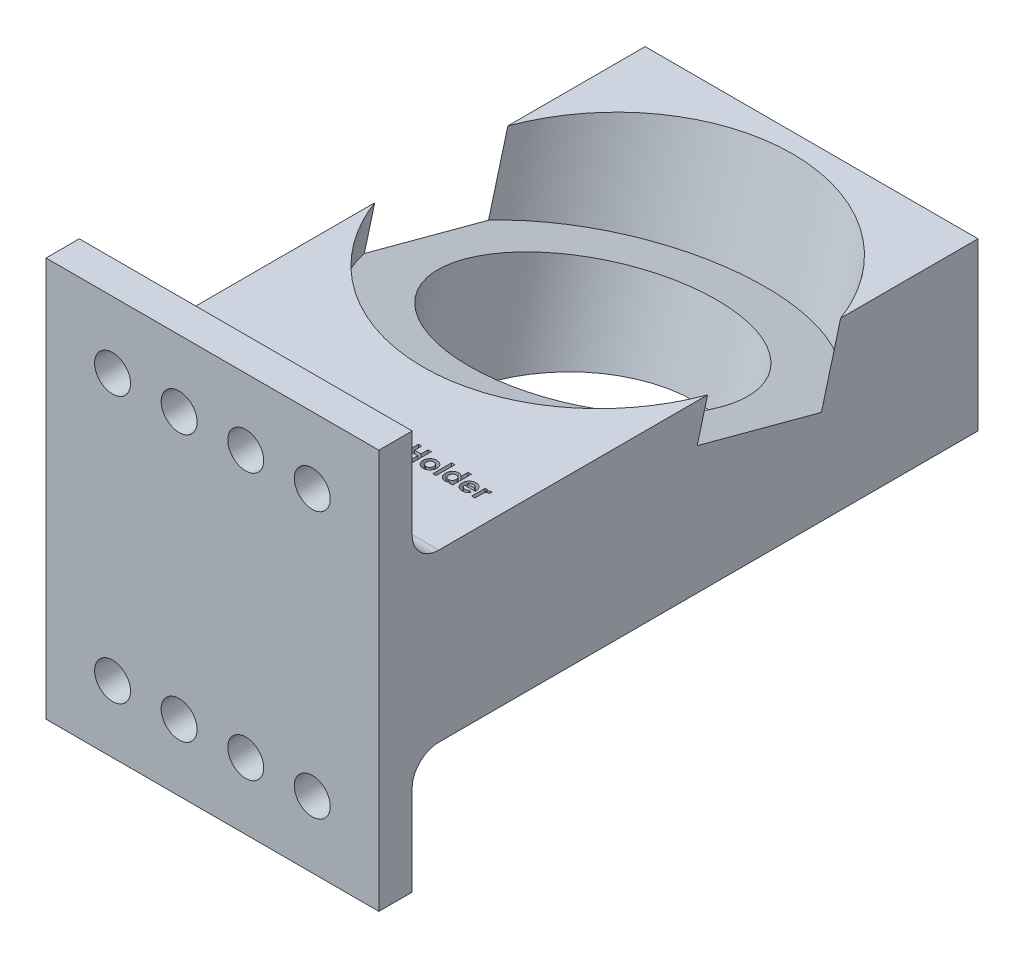
from build123d import *

# Parameters (mm, degrees)
SKETCH1_W           = 107.95
SKETCH1_H           = 31.75
BOSS_EXTRUDE1_DEPTH = 31.75
SKETCH3_W           = 63.5
SKETCH3_H           = 76.2
SKETCH3_R           = 3.429
BOSS_EXTRUDE2_DEPTH = 6.35
FILLET1_R           = 5.08
SKETCH4_W           = 0.628205128
SKETCH4_H           = 3.58974359
SKETCH4_W_2         = 0.628205129
CUT_EXTRUDE1_DEPTH  = 2.54


with BuildPart() as part:
    # Sketch1 → Boss-Extrude1 (new, symmetric)
    with BuildSketch(Plane(origin=(0, 0, 0), x_dir=(0, 0, -1), z_dir=(1, 0, 0))):
        Rectangle(SKETCH1_W, SKETCH1_H)
    extrude(amount=BOSS_EXTRUDE1_DEPTH, both=True)

    # Sketch2 → Cut-Revolve1 (revolve, cut)
    with BuildSketch(Plane(origin=(0, 0, 0), x_dir=(0, 0, -1), z_dir=(1, 0, 0))):
        Polygon((35.867113889, -1.024256513), (26.789471638, -34.902478605), (3.175, -28.575), (21.014173595, 38.001702221), (53.890425018, 29.192537202), (45.128893674, -3.505942927), align=None)
    revolve(axis=Axis((0, -40.424261314, 0), (0, 0.9659258262890701, -0.2588190451025143)), mode=Mode.SUBTRACT)

    # Sketch3 → Boss-Extrude2 (add)
    with BuildSketch(Plane.XY.offset(53.975)):
        Rectangle(SKETCH3_W, SKETCH3_H)
        with Locations((-19.05, 25.4)):
            Circle(SKETCH3_R, mode=Mode.SUBTRACT)
        with Locations((-6.35, 25.4)):
            Circle(SKETCH3_R, mode=Mode.SUBTRACT)
        with Locations((6.35, 25.4)):
            Circle(SKETCH3_R, mode=Mode.SUBTRACT)
        with Locations((19.05, 25.4)):
            Circle(SKETCH3_R, mode=Mode.SUBTRACT)
        with Locations((-6.35, -25.4)):
            Circle(SKETCH3_R, mode=Mode.SUBTRACT)
        with Locations((6.35, -25.4)):
            Circle(SKETCH3_R, mode=Mode.SUBTRACT)
        with Locations((19.05, -25.4)):
            Circle(SKETCH3_R, mode=Mode.SUBTRACT)
        with Locations((-19.05, -25.4)):
            Circle(SKETCH3_R, mode=Mode.SUBTRACT)
    extrude(amount=BOSS_EXTRUDE2_DEPTH)

    # Fillet1
    fillet1_edges = [part.edges().sort_by_distance(p)[0] for p in [
        (0, 15.875, 53.975),
        (0, -15.875, 53.975),
    ]]
    fillet(fillet1_edges, radius=FILLET1_R)

    # Sketch4 → Cut-Extrude1 (cut)
    # profile 1 of 19: a face of its own
    with BuildSketch(Plane(origin=(0, 15.875, 0), x_dir=(1, 0, 0), z_dir=(0, 1, 0))):
        with BuildLine():
            Line((-25.837740385, -33.244778991), (-25.281750801, -33.526629953))
            Line((-25.281750801, -33.526629953), (-25.891726763, -34.725548222))
            add(Edge.make_bspline(
                [(-25.891726763, -34.725548222), (-25.855689955, -34.726481233), (-25.784709553, -34.728318951), (-25.680276294, -34.743171699), (-25.580436155, -34.768848538), (-25.484182451, -34.802883118), (-25.392691793, -34.848591898), (-25.304490673, -34.902964876), (-25.221860898, -34.969278571), (-25.142907839, -35.042750627), (-25.071116228, -35.124147106), (-25.008752522, -35.211610208), (-24.954403653, -35.303011945), (-24.91215503, -35.400397197), (-24.878075883, -35.502151691), (-24.853486279, -35.608682185), (-24.839457222, -35.720297166), (-24.837523082, -35.796122279), (-24.836538462, -35.834722901)],
                knots=[0, 0, 0, 0, 1.013260694, 1.995783107, 2.958651975, 3.908806537, 4.861209129, 5.829647963, 6.817170299, 7.835534541, 8.860094905, 9.863329007, 10.853101798, 11.844815043, 12.84250023, 13.867713965, 14.914507806, 16, 16, 16, 16], degree=3))
            add(Edge.make_bspline(
                [(-24.836538462, -35.834722901), (-24.837461133, -35.87193156), (-24.839284858, -35.945477122), (-24.854360363, -36.053496848), (-24.878723171, -36.157135459), (-24.913542515, -36.256185974), (-24.957800718, -36.351132556), (-25.011925502, -36.441919489), (-25.076365728, -36.527868352), (-25.149456438, -36.608522454), (-25.229357192, -36.682039264), (-25.31357694, -36.747385284), (-25.402829348, -36.801363575), (-25.495427441, -36.846949508), (-25.593076006, -36.880966488), (-25.694313729, -36.906643416), (-25.799908325, -36.921460118), (-25.871583231, -36.923323335), (-25.907852564, -36.924266171)],
                knots=[0, 0, 0, 0, 1.049934834, 2.075270938, 3.072134561, 4.05064612, 5.033440221, 6.024524368, 7.028587226, 8.060776465, 9.092543989, 10.090062252, 11.064205434, 12.031961459, 12.998029633, 13.977230324, 14.976426867, 16, 16, 16, 16], degree=3))
            add(Edge.make_bspline(
                [(-25.907852564, -36.924266171), (-25.945779265, -36.923492436), (-26.020356991, -36.92197099), (-26.129482869, -36.904934814), (-26.234143977, -36.879289225), (-26.333752104, -36.842671681), (-26.428926683, -36.796046185), (-26.518547205, -36.738351823), (-26.603368599, -36.67022481), (-26.682486544, -36.593197896), (-26.753765916, -36.50882545), (-26.817341158, -36.421224884), (-26.871125896, -36.330258733), (-26.914663387, -36.236024259), (-26.948632347, -36.138821742), (-26.972267815, -36.038466701), (-26.987668504, -35.935225327), (-26.989473883, -35.865159888), (-26.990384615, -35.829815049)],
                knots=[0, 0, 0, 0, 1.063775006, 2.091769615, 3.092589432, 4.084662827, 5.064601646, 6.061867366, 7.070035304, 8.113879863, 9.156342271, 10.166834137, 11.149076039, 12.117706134, 13.076241869, 14.034148791, 15.008317125, 16, 16, 16, 16], degree=3))
            add(Edge.make_bspline(
                [(-26.990384615, -35.829815049), (-26.989903402, -35.802444605), (-26.988938298, -35.747551363), (-26.979239574, -35.665351716), (-26.964494107, -35.582936303), (-26.94740218, -35.513391567), (-26.92980264, -35.454584215), (-26.912088568, -35.404817142), (-26.890135879, -35.349586574), (-26.865040704, -35.288751472), (-26.83601389, -35.222385023), (-26.803207069, -35.150668123), (-26.766538566, -35.073057679), (-26.740388873, -35.019751321), (-26.726762821, -34.991974504)],
                knots=[0, 0, 0, 0, 1.110454016, 2.227089276, 3.35462975, 4.507227546, 5.131400587, 5.845402449, 6.650387134, 7.543487832, 8.516250726, 9.590168902, 10.744287919, 12, 12, 12, 12], degree=3))
            Line((-26.726762821, -34.991974504), (-25.837740385, -33.244778991))
        make_face()
        with BuildLine():
            add(Edge.make_bspline(
                [(-25.921875, -35.308881555), (-25.952018194, -35.31026416), (-26.011004468, -35.312969736), (-26.094874128, -35.341303842), (-26.171344229, -35.385753003), (-26.237629459, -35.447657056), (-26.293070954, -35.52163483), (-26.33381131, -35.606016363), (-26.358318899, -35.699675606), (-26.36086508, -35.765160587), (-26.362179487, -35.79896569)],
                knots=[0, 0, 0, 0, 0.981744412, 1.921144944, 2.858899012, 3.85339082, 4.86292663, 5.863643845, 6.897155691, 8, 8, 8, 8], degree=3))
            add(Edge.make_bspline(
                [(-26.362179487, -35.79896569), (-26.360623188, -35.83278205), (-26.357596082, -35.89855713), (-26.332166976, -35.993108176), (-26.29053164, -36.079405916), (-26.232140736, -36.154364056), (-26.163590653, -36.216585116), (-26.087576742, -36.262600565), (-26.005366943, -36.290869365), (-25.948500417, -36.294318534), (-25.919771635, -36.296061042)],
                knots=[0, 0, 0, 0, 1.098279937, 2.136227893, 3.159405121, 4.194678092, 5.206500211, 6.154139736, 7.067477469, 8, 8, 8, 8], degree=3))
            add(Edge.make_bspline(
                [(-25.919771635, -36.296061042), (-25.889430794, -36.294287498), (-25.829927135, -36.290809271), (-25.744089206, -36.26372997), (-25.665675742, -36.218485431), (-25.596343072, -36.156463577), (-25.536787626, -36.08236081), (-25.495581273, -35.995556169), (-25.468976568, -35.900322687), (-25.466186218, -35.833508857), (-25.46474359, -35.79896569)],
                knots=[0, 0, 0, 0, 0.96921794, 1.900804717, 2.848419905, 3.844199796, 4.861108892, 5.867439427, 6.897452859, 8, 8, 8, 8], degree=3))
            add(Edge.make_bspline(
                [(-25.46474359, -35.79896569), (-25.466387007, -35.765180326), (-25.469569677, -35.699751023), (-25.493475297, -35.605653008), (-25.536157169, -35.521596713), (-25.592853073, -35.447351687), (-25.661419488, -35.385475238), (-25.740950079, -35.340953302), (-25.828651045, -35.313019935), (-25.890347278, -35.310281128), (-25.921875, -35.308881555)],
                knots=[0, 0, 0, 0, 1.083229974, 2.097801324, 3.086792542, 4.086858909, 5.079819718, 6.026392613, 6.991456328, 8, 8, 8, 8], degree=3))
        make_face(mode=Mode.SUBTRACT)
    # profile 2 of 19: a face of its own
    with BuildSketch(Plane(origin=(0, 15.875, 0), x_dir=(1, 0, 0), z_dir=(0, 1, 0))):
        Polygon((-24.253205128, -33.334522581), (-22.009615385, -33.334522581), (-22.009615385, -33.660544216), (-23.553485577, -36.924266171), (-24.110176282, -36.643817453), (-22.820112179, -33.917855914), (-24.253205128, -33.917855914), align=None)
    # profile 3 of 19: a face of its own
    with BuildSketch(Plane(origin=(0, 15.875, 0), x_dir=(1, 0, 0), z_dir=(0, 1, 0))):
        with BuildLine():
            add(Edge.make_bspline(
                [(-20.516927083, -33.244778991), (-20.486519348, -33.245230403), (-20.426729615, -33.246117998), (-20.338670594, -33.25573138), (-20.253845409, -33.270254518), (-20.171922215, -33.290509232), (-20.093490703, -33.317315624), (-20.017980032, -33.349402415), (-19.946288997, -33.388452625), (-19.877503309, -33.432561843), (-19.811649465, -33.48249973), (-19.750310214, -33.5394315), (-19.692365373, -33.602047151), (-19.639069233, -33.671293318), (-19.589241535, -33.746540134), (-19.543046006, -33.827799531), (-19.500836282, -33.91546922), (-19.462139294, -34.009707407), (-19.427536325, -34.111926682), (-19.398390287, -34.223299544), (-19.373392683, -34.343851428), (-19.352292941, -34.473882405), (-19.336344947, -34.613565317), (-19.325595677, -34.762807367), (-19.31821902, -34.921320837), (-19.317616988, -35.030059775), (-19.317307692, -35.085924825)],
                knots=[0, 0, 0, 0, 0.879237366, 1.728815576, 2.559023295, 3.367336655, 4.166867292, 4.954216142, 5.737608147, 6.525189134, 7.316157332, 8.124696809, 8.942788509, 9.781158001, 10.649253743, 11.551476218, 12.482711956, 13.461909668, 14.496590415, 15.601789533, 16.789733467, 18.056700938, 19.410929216, 20.8549011, 22.384193279, 24, 24, 24, 24], degree=3))
            add(Edge.make_bspline(
                [(-19.317307692, -35.085924825), (-19.317641958, -35.142488809), (-19.318291429, -35.252391616), (-19.325289027, -35.412354931), (-19.337339222, -35.562680567), (-19.352870382, -35.703352973), (-19.374143824, -35.834297862), (-19.399057981, -35.955854292), (-19.42866408, -36.067978203), (-19.464406859, -36.170416956), (-19.502869613, -36.264820646), (-19.545194799, -36.3523194), (-19.590644693, -36.433150212), (-19.638176814, -36.508532526), (-19.690397045, -36.57624411), (-19.744763682, -36.63858751), (-19.803643944, -36.693187988), (-19.864558746, -36.742859406), (-19.929739642, -36.785785479), (-19.99851444, -36.823327915), (-20.072109274, -36.85377929), (-20.149182636, -36.880264269), (-20.231048257, -36.899277626), (-20.316405303, -36.914364101), (-20.406217439, -36.922701812), (-20.467365158, -36.92373616), (-20.498697917, -36.924266171)],
                knots=[0, 0, 0, 0, 1.643780988, 3.193836972, 4.651895693, 6.025988579, 7.305620092, 8.505800249, 9.631074763, 10.672816429, 11.65661981, 12.592235626, 13.49536222, 14.350718032, 15.179365177, 15.97804903, 16.751647189, 17.51006938, 18.259804725, 19.016521909, 19.783502495, 20.571750527, 21.382245291, 22.22305063, 23.089471752, 24, 24, 24, 24], degree=3))
            add(Edge.make_bspline(
                [(-20.498697917, -36.924266171), (-20.53002983, -36.923725936), (-20.591408586, -36.922667624), (-20.681463583, -36.914426095), (-20.767272978, -36.899216511), (-20.849786288, -36.880118299), (-20.928429232, -36.853837891), (-21.0035789, -36.822475433), (-21.074657457, -36.785167243), (-21.141861708, -36.742141156), (-21.204962198, -36.692802077), (-21.26493951, -36.637677743), (-21.321660969, -36.57690788), (-21.374263701, -36.509811816), (-21.423609188, -36.437285142), (-21.469182833, -36.35849964), (-21.510957249, -36.273570019), (-21.550239146, -36.182377897), (-21.584370142, -36.082960011), (-21.614745144, -35.974428572), (-21.639627546, -35.855878881), (-21.65963964, -35.727349024), (-21.675617283, -35.589111296), (-21.687502814, -35.441098975), (-21.69453928, -35.283243119), (-21.695181941, -35.174740926), (-21.695512821, -35.118877549)],
                knots=[0, 0, 0, 0, 0.917216111, 1.796812873, 2.643793957, 3.46689424, 4.273913431, 5.068098542, 5.848489301, 6.620921603, 7.401012384, 8.190319798, 9.003608147, 9.831726257, 10.68377682, 11.569763213, 12.493818149, 13.453288342, 14.474581811, 15.568529029, 16.750744269, 18.018426408, 19.375425659, 20.823733699, 22.36466933, 24, 24, 24, 24], degree=3))
            add(Edge.make_bspline(
                [(-21.695512821, -35.118877549), (-21.694913463, -35.041259784), (-21.693756994, -34.891495306), (-21.679101374, -34.675129179), (-21.65759064, -34.475136175), (-21.625996468, -34.291850832), (-21.586930711, -34.124594316), (-21.536904975, -33.974468425), (-21.479954314, -33.839395829), (-21.431425034, -33.75937801), (-21.408052885, -33.72084069)],
                knots=[0, 0, 0, 0, 1.288568992, 2.486310467, 3.599230591, 4.627010532, 5.572937695, 6.447898582, 7.252493626, 8, 8, 8, 8], degree=3))
            add(Edge.make_bspline(
                [(-21.408052885, -33.72084069), (-21.380876863, -33.682981638), (-21.327742385, -33.608959733), (-21.234835265, -33.511782807), (-21.135018661, -33.428672342), (-21.026242397, -33.361509201), (-20.910226815, -33.308544343), (-20.785975861, -33.27113586), (-20.653948374, -33.249339934), (-20.563282897, -33.246322009), (-20.516927083, -33.244778991)],
                knots=[0, 0, 0, 0, 1.058512271, 2.069600068, 3.047294572, 4.004278952, 4.967380941, 5.939006123, 6.946246673, 8, 8, 8, 8], degree=3))
        make_face()
        with BuildLine():
            add(Edge.make_bspline(
                [(-20.501502404, -33.872984119), (-20.528991249, -33.874287036), (-20.582883977, -33.876841444), (-20.661084894, -33.898524766), (-20.734823476, -33.932015825), (-20.790914445, -33.972317078), (-20.832897978, -34.010950663), (-20.862232174, -34.0459128), (-20.890520382, -34.084928026), (-20.915505952, -34.129756896), (-20.939098852, -34.178788657), (-20.962156227, -34.232245883), (-20.98105722, -34.2914416), (-20.999626945, -34.355367696), (-21.015895756, -34.425791559), (-21.029525454, -34.503288825), (-21.04170239, -34.588363467), (-21.050195948, -34.681071209), (-21.058114494, -34.781315055), (-21.063790882, -34.88931831), (-21.066164038, -35.005051837), (-21.066918392, -35.0847558), (-21.067307692, -35.125888767)],
                knots=[0, 0, 0, 0, 1.076674018, 2.110852608, 3.161083442, 4.239746716, 4.804137807, 5.395870207, 6.026861976, 6.692161227, 7.405688833, 8.16177676, 8.973626916, 9.841385931, 10.773283133, 11.807421078, 12.927755683, 14.143907515, 15.458935494, 16.872852025, 18.386167141, 20, 20, 20, 20], degree=3))
            add(Edge.make_bspline(
                [(-21.067307692, -35.125888767), (-21.06666695, -35.179178514), (-21.06543828, -35.281365555), (-21.059003081, -35.428314078), (-21.046104259, -35.562049066), (-21.030060728, -35.683476892), (-21.007526933, -35.791810062), (-20.981600344, -35.888073511), (-20.949583312, -35.971040111), (-20.912581462, -36.041909747), (-20.871600246, -36.1021984), (-20.827113333, -36.153444026), (-20.780635344, -36.19782032), (-20.730715548, -36.233866637), (-20.67747304, -36.261490873), (-20.621352297, -36.281360645), (-20.562317655, -36.293523759), (-20.521891341, -36.295210392), (-20.501502404, -36.296061042)],
                knots=[0, 0, 0, 0, 1.771748488, 3.397459088, 4.888034009, 6.237357457, 7.467047327, 8.564189669, 9.548206622, 10.417051504, 11.216568818, 11.965764335, 12.669334354, 13.348544111, 14.005342236, 14.656555988, 15.322436492, 16, 16, 16, 16], degree=3))
            add(Edge.make_bspline(
                [(-20.501502404, -36.296061042), (-20.48181315, -36.295478964), (-20.443264041, -36.294339328), (-20.387050805, -36.282641112), (-20.333891575, -36.263622354), (-20.283946855, -36.236718986), (-20.237038, -36.202507237), (-20.193394271, -36.160836766), (-20.153344821, -36.111292215), (-20.130011829, -36.074522831), (-20.117988782, -36.055576267)],
                knots=[0, 0, 0, 0, 0.992283464, 1.942767638, 2.88273346, 3.832339453, 4.79467288, 5.803907806, 6.868395428, 8, 8, 8, 8], degree=3))
            add(Edge.make_bspline(
                [(-20.117988782, -36.055576267), (-20.103833669, -36.029686392), (-20.074151545, -35.975397423), (-20.039803339, -35.883786813), (-20.010890934, -35.780465187), (-19.98600645, -35.665110996), (-19.968986981, -35.537269271), (-19.954329835, -35.397750666), (-19.947260329, -35.245852623), (-19.946110435, -35.140617111), (-19.945512821, -35.085924825)],
                knots=[0, 0, 0, 0, 0.710965849, 1.490837728, 2.352621235, 3.297892224, 4.334225155, 5.461620853, 6.680770821, 8, 8, 8, 8], degree=3))
            add(Edge.make_bspline(
                [(-19.945512821, -35.085924825), (-19.945743666, -35.030757783), (-19.946188005, -34.924570646), (-19.954340332, -34.772126518), (-19.96569307, -34.632894108), (-19.982298849, -34.507184265), (-20.003665201, -34.39469182), (-20.029999311, -34.295424127), (-20.061045268, -34.209185548), (-20.097862073, -34.136062076), (-20.138638971, -34.073917155), (-20.181924894, -34.020601634), (-20.227902872, -33.975082187), (-20.276496014, -33.937187516), (-20.328829025, -33.908233146), (-20.383902278, -33.887788965), (-20.441828676, -33.875420922), (-20.48134268, -33.87380735), (-20.501502404, -33.872984119)],
                knots=[0, 0, 0, 0, 1.793836731, 3.452829483, 4.963243077, 6.335886805, 7.574563692, 8.684454726, 9.672768357, 10.54971625, 11.340229787, 12.085688095, 12.778991901, 13.440269426, 14.083255152, 14.715733572, 15.344777694, 16, 16, 16, 16], degree=3))
        make_face(mode=Mode.SUBTRACT)
    # profile 4 of 19: a face of its own
    with BuildSketch(Plane(origin=(0, 15.875, 0), x_dir=(1, 0, 0), z_dir=(0, 1, 0))):
        Polygon((-17.477564103, -33.244778991), (-16.849358974, -33.244778991), (-16.849358974, -35.338328671), (-15.871995192, -34.276830273), (-15.095853365, -34.276830273), (-16.218349359, -35.496081075), (-14.935296474, -36.834522581), (-15.726161859, -36.834522581), (-16.849358974, -35.662948062), (-16.849358974, -36.834522581), (-17.477564103, -36.834522581), align=None)
    # profile 5 of 19: a face of its own
    with BuildSketch(Plane(origin=(0, 15.875, 0), x_dir=(1, 0, 0), z_dir=(0, 1, 0))):
        Polygon((-14.560897436, -33.334522581), (-13.932692308, -33.334522581), (-13.932692308, -34.680676427), (-12.721153846, -34.680676427), (-12.721153846, -33.334522581), (-12.092948718, -33.334522581), (-12.092948718, -36.834522581), (-12.721153846, -36.834522581), (-12.721153846, -35.308881555), (-13.932692308, -35.308881555), (-13.932692308, -36.834522581), (-14.560897436, -36.834522581), align=None)
    # profile 6 of 19: a face of its own
    with BuildSketch(Plane(origin=(0, 15.875, 0), x_dir=(1, 0, 0), z_dir=(0, 1, 0))):
        Polygon((-11.46474359, -34.276830273), (-9.490384615, -34.276830273), (-10.666866987, -36.296061042), (-9.580128205, -36.296061042), (-9.580128205, -36.834522581), (-11.644230769, -36.834522581), (-10.467748397, -34.815291812), (-11.46474359, -34.815291812), align=None)
    # profile 7 of 19: a face of its own
    with BuildSketch(Plane(origin=(0, 15.875, 0), x_dir=(1, 0, 0), z_dir=(0, 1, 0))):
        with BuildLine():
            Line((-4.554487179, -33.941694055), (-5.015124199, -34.381998542))
            add(Edge.make_bspline(
                [(-5.015124199, -34.381998542), (-5.054199183, -34.341594943), (-5.13052487, -34.262674055), (-5.253514275, -34.158189754), (-5.381418778, -34.071116226), (-5.511750253, -33.997783456), (-5.646852984, -33.942301988), (-5.785164816, -33.901871709), (-5.927568911, -33.877222895), (-6.023942526, -33.874402635), (-6.072415865, -33.872984119)],
                knots=[0, 0, 0, 0, 1.115251505, 2.178435587, 3.19620269, 4.182487026, 5.141301733, 6.088180966, 7.038406374, 8, 8, 8, 8], degree=3))
            add(Edge.make_bspline(
                [(-6.072415865, -33.872984119), (-6.112896995, -33.874104796), (-6.192782043, -33.876316328), (-6.310074228, -33.892529038), (-6.422270265, -33.920099457), (-6.529754218, -33.958096602), (-6.632209812, -34.007262891), (-6.729851856, -34.06756027), (-6.82243962, -34.138444168), (-6.908750072, -34.219547829), (-6.98770384, -34.308159673), (-7.057464522, -34.4027083), (-7.115900283, -34.502977103), (-7.163857561, -34.607950634), (-7.201214427, -34.718114763), (-7.227891923, -34.833395321), (-7.243321474, -34.953929601), (-7.245624438, -35.035867906), (-7.246794872, -35.077511363)],
                knots=[0, 0, 0, 0, 1.035432265, 2.043311493, 3.022114605, 3.98653278, 4.95457646, 5.923598177, 6.917315552, 7.932509744, 8.948865224, 9.949768934, 10.933144597, 11.912367597, 12.897413939, 13.903909035, 14.934704909, 16, 16, 16, 16], degree=3))
            add(Edge.make_bspline(
                [(-7.246794872, -35.077511363), (-7.246457566, -35.106739655), (-7.24579273, -35.164349219), (-7.238514918, -35.249569752), (-7.226795926, -35.332253817), (-7.209835641, -35.412276169), (-7.188626637, -35.489706155), (-7.163743647, -35.565211761), (-7.132528301, -35.637749669), (-7.097878797, -35.708162359), (-7.057581822, -35.774528534), (-7.01413425, -35.83781419), (-6.967022452, -35.897709106), (-6.915941281, -35.953968431), (-6.860171834, -36.005712957), (-6.801155545, -36.054498704), (-6.737896891, -36.099104399), (-6.671709913, -36.140649471), (-6.602022841, -36.176740029), (-6.530726446, -36.209431102), (-6.456739732, -36.235981114), (-6.38096353, -36.257382846), (-6.303668638, -36.275581822), (-6.224099041, -36.286787491), (-6.142944507, -36.295273413), (-6.088097664, -36.295797369), (-6.060496795, -36.296061042)],
                knots=[0, 0, 0, 0, 1.103660481, 2.175337485, 3.227646561, 4.255952547, 5.262355991, 6.258840057, 7.255597736, 8.242457506, 9.22035537, 10.185017736, 11.140346927, 12.096287581, 13.051739095, 14.01125915, 14.986044842, 15.97314143, 16.960198552, 17.947847494, 18.933482797, 19.925264591, 20.920966487, 21.929612487, 22.958107872, 24, 24, 24, 24], degree=3))
            add(Edge.make_bspline(
                [(-6.060496795, -36.296061042), (-6.013680978, -36.294706881), (-5.921700072, -36.292046305), (-5.786704866, -36.271240978), (-5.658067884, -36.237017392), (-5.55528755, -36.196601326), (-5.474761874, -36.156689936), (-5.413458867, -36.119773866), (-5.35006678, -36.078479188), (-5.285638501, -36.031247397), (-5.21944934, -35.978645294), (-5.152667688, -35.919520793), (-5.083583923, -35.855820779), (-5.038327834, -35.810356829), (-5.015124199, -35.787046619)],
                knots=[0, 0, 0, 0, 1.404581149, 2.759636711, 4.088442092, 5.392261763, 6.066678138, 6.783632037, 7.538459478, 8.336747902, 9.180226004, 10.074962426, 11.012997595, 12, 12, 12, 12], degree=3))
            Line((-5.015124199, -35.787046619), (-4.568509615, -36.2560971))
            add(Edge.make_bspline(
                [(-4.568509615, -36.2560971), (-4.599904217, -36.286407602), (-4.661179764, -36.34556722), (-4.753612227, -36.429568356), (-4.84592836, -36.505052716), (-4.935897997, -36.574760049), (-5.024994936, -36.636659612), (-5.113209727, -36.690813226), (-5.199543741, -36.738590513), (-5.28578973, -36.779185732), (-5.372484363, -36.81365529), (-5.461682952, -36.843331316), (-5.553658186, -36.868436167), (-5.648971807, -36.888692485), (-5.746734789, -36.904935317), (-5.847862063, -36.915899134), (-5.951712431, -36.923269744), (-6.022155745, -36.923932055), (-6.057692308, -36.924266171)],
                knots=[0, 0, 0, 0, 1.244526981, 2.429050516, 3.560637417, 4.644440555, 5.67424972, 6.652764056, 7.595344123, 8.486817594, 9.369275933, 10.254498637, 11.166417451, 12.086725134, 13.032340136, 13.991389299, 14.986715468, 16, 16, 16, 16], degree=3))
            add(Edge.make_bspline(
                [(-6.057692308, -36.924266171), (-6.122968572, -36.922602149), (-6.250696076, -36.91934612), (-6.437877402, -36.895221151), (-6.615694638, -36.854776066), (-6.784580379, -36.797575559), (-6.944480923, -36.724504593), (-7.095355363, -36.63492302), (-7.236960523, -36.529068844), (-7.368152513, -36.408182778), (-7.48682191, -36.274674267), (-7.591711915, -36.131322753), (-7.678476932, -35.977423715), (-7.750519794, -35.815250735), (-7.806856365, -35.644063753), (-7.84650776, -35.463677599), (-7.870960487, -35.274266444), (-7.87363565, -35.14489426), (-7.875, -35.078913607)],
                knots=[0, 0, 0, 0, 1.078019885, 2.10938526, 3.111377082, 4.085535484, 5.04941344, 6.010039228, 6.978205633, 7.964457913, 8.951525778, 9.924444315, 10.892603023, 11.863865945, 12.85144698, 13.863884204, 14.910567087, 16, 16, 16, 16], degree=3))
            add(Edge.make_bspline(
                [(-7.875, -35.078913607), (-7.874423492, -35.035881587), (-7.873280993, -34.950602643), (-7.861273226, -34.824979848), (-7.8445337, -34.702520094), (-7.817977964, -34.584494918), (-7.785967644, -34.469314304), (-7.746158605, -34.35823013), (-7.698614427, -34.25092313), (-7.644867573, -34.147213664), (-7.584064294, -34.047781141), (-7.516140357, -33.953479843), (-7.442844388, -33.863581782), (-7.362415205, -33.779279622), (-7.276021549, -33.699833174), (-7.183273363, -33.625672973), (-7.08472848, -33.555735478), (-6.980120177, -33.491824208), (-6.871480714, -33.434013067), (-6.76018032, -33.383021171), (-6.646492448, -33.34040369), (-6.53089778, -33.30505406), (-6.41290793, -33.278668062), (-6.29336508, -33.258694712), (-6.171252064, -33.247529482), (-6.089263752, -33.245701662), (-6.047876603, -33.244778991)],
                knots=[0, 0, 0, 0, 1.071919942, 2.124283339, 3.142214191, 4.149696895, 5.136002878, 6.119640489, 7.086990633, 8.058538607, 9.028339693, 9.988281803, 10.952401235, 11.916291999, 12.888973767, 13.874849856, 14.873389453, 15.898127285, 16.927174885, 17.938320013, 18.946391617, 19.950418109, 20.947802303, 21.956882652, 22.968648068, 24, 24, 24, 24], degree=3))
            add(Edge.make_bspline(
                [(-6.047876603, -33.244778991), (-6.01256912, -33.245307889), (-5.942321255, -33.246360186), (-5.837710396, -33.255132227), (-5.733936166, -33.268908628), (-5.631370108, -33.289694283), (-5.529278565, -33.314369482), (-5.429003134, -33.346678252), (-5.328961916, -33.382692464), (-5.23072391, -33.425740102), (-5.134151988, -33.472730486), (-5.041508501, -33.526042784), (-4.951237973, -33.582396216), (-4.865340745, -33.645126025), (-4.782207776, -33.711956884), (-4.702273776, -33.783200596), (-4.626240214, -33.860045005), (-4.578525771, -33.914340115), (-4.554487179, -33.941694055)],
                knots=[0, 0, 0, 0, 0.996412454, 1.982464992, 2.961075852, 3.949442424, 4.934965278, 5.923860011, 6.921385422, 7.934793307, 8.949617135, 9.951082467, 10.950285876, 11.951772932, 12.951063433, 13.960125323, 14.972308753, 16, 16, 16, 16], degree=3))
        make_face()
    # profile 8 of 19: a face of its own
    with BuildSketch(Plane(origin=(0, 15.875, 0), x_dir=(1, 0, 0), z_dir=(0, 1, 0))):
        with BuildLine():
            Line((-2.086538462, -34.276830273), (-1.458333333, -34.276830273))
            Line((-1.458333333, -34.276830273), (-1.458333333, -36.834522581))
            Line((-1.458333333, -36.834522581), (-2.086538462, -36.834522581))
            Line((-2.086538462, -36.834522581), (-2.086538462, -36.555476107))
            add(Edge.make_bspline(
                [(-2.086538462, -36.555476107), (-2.117665794, -36.582638192), (-2.1780778, -36.635354437), (-2.273267573, -36.703755105), (-2.368735501, -36.760176816), (-2.46494031, -36.805113632), (-2.563360629, -36.838294845), (-2.664705044, -36.862318818), (-2.770433022, -36.876486343), (-2.842305445, -36.878414934), (-2.87880609, -36.879394376)],
                knots=[0, 0, 0, 0, 1.129196829, 2.191548051, 3.199897424, 4.157751732, 5.089409408, 6.034969131, 7.002052659, 8, 8, 8, 8], degree=3))
            add(Edge.make_bspline(
                [(-2.87880609, -36.879394376), (-2.919779686, -36.878472598), (-3.000745834, -36.876651113), (-3.119554668, -36.857477043), (-3.234276408, -36.828126856), (-3.344817933, -36.786592673), (-3.450978123, -36.732772515), (-3.553569424, -36.668070623), (-3.65083311, -36.590215576), (-3.743578867, -36.502575962), (-3.828496326, -36.406171764), (-3.90273197, -36.302341058), (-3.965307101, -36.192556453), (-4.016571557, -36.077181936), (-4.056897672, -35.956302185), (-4.085644422, -35.829533807), (-4.102605037, -35.696831526), (-4.104704283, -35.60643993), (-4.105769231, -35.56058428)],
                knots=[0, 0, 0, 0, 0.980476535, 1.937477201, 2.874147792, 3.812856188, 4.758993464, 5.720109578, 6.712210464, 7.737600662, 8.772720504, 9.783789959, 10.789002326, 11.793715968, 12.802552247, 13.835794126, 14.902098527, 16, 16, 16, 16], degree=3))
            add(Edge.make_bspline(
                [(-4.105769231, -35.56058428), (-4.104651564, -35.513100694), (-4.102459137, -35.419956349), (-4.086421664, -35.283271452), (-4.0582054, -35.153359863), (-4.019730496, -35.030041635), (-3.970239213, -34.913295462), (-3.909962137, -34.802930079), (-3.838079255, -34.699233961), (-3.755246976, -34.603972091), (-3.665808459, -34.516659985), (-3.570125058, -34.440647874), (-3.469693051, -34.376072048), (-3.364405712, -34.323353114), (-3.254278076, -34.28261459), (-3.139744926, -34.252831402), (-3.020297814, -34.234960444), (-2.938929474, -34.232967444), (-2.897736378, -34.231958478)],
                knots=[0, 0, 0, 0, 1.136281865, 2.228943489, 3.287578264, 4.313574083, 5.316051562, 6.317280042, 7.318008486, 8.329309503, 9.333984563, 10.305318864, 11.248632312, 12.186624717, 13.117503092, 14.05354244, 15.014596925, 16, 16, 16, 16], degree=3))
            add(Edge.make_bspline(
                [(-2.897736378, -34.231958478), (-2.859578224, -34.232751222), (-2.784076991, -34.234319776), (-2.673101057, -34.25135127), (-2.565470407, -34.277110194), (-2.461772172, -34.313812026), (-2.361155784, -34.360155554), (-2.265351909, -34.41822745), (-2.172264749, -34.485586976), (-2.115466946, -34.538196194), (-2.086538462, -34.564991331)],
                knots=[0, 0, 0, 0, 1.017011718, 2.012299608, 2.98747302, 3.965332399, 4.941441765, 5.936729654, 6.94912688, 8, 8, 8, 8], degree=3))
            Line((-2.086538462, -34.564991331), (-2.086538462, -34.276830273))
        make_face()
        with BuildLine():
            add(Edge.make_bspline(
                [(-2.765925481, -34.815291812), (-2.790957603, -34.816059884), (-2.840018929, -34.817565254), (-2.912170323, -34.826620165), (-2.98112541, -34.842575321), (-3.04639241, -34.866145637), (-3.108944039, -34.894857717), (-3.167830443, -34.930819124), (-3.223537627, -34.973324743), (-3.275737973, -35.021345514), (-3.323326279, -35.074129121), (-3.364350176, -35.131727472), (-3.399213861, -35.19258862), (-3.428699478, -35.256895552), (-3.449804489, -35.325409219), (-3.46651965, -35.397237695), (-3.475193736, -35.472967781), (-3.476766075, -35.52457549), (-3.477564103, -35.550768575)],
                knots=[0, 0, 0, 0, 1.04836806, 2.054732945, 3.03993516, 4.00574415, 4.955904794, 5.917688631, 6.888591924, 7.88601754, 8.884115178, 9.859153345, 10.841239365, 11.818093293, 12.814750328, 13.83810466, 14.90274714, 16, 16, 16, 16], degree=3))
            add(Edge.make_bspline(
                [(-3.477564103, -35.550768575), (-3.476778265, -35.577199245), (-3.47522978, -35.629280576), (-3.466379399, -35.705649472), (-3.450265718, -35.778527193), (-3.426756467, -35.847324571), (-3.398046217, -35.912969911), (-3.363099387, -35.975160254), (-3.320173327, -36.032795997), (-3.272543305, -36.087240994), (-3.219272077, -36.135858263), (-3.163249679, -36.179025934), (-3.103710889, -36.215144298), (-3.04130166, -36.244335387), (-2.976232065, -36.268123671), (-2.907686328, -36.283878304), (-2.836335941, -36.293949942), (-2.787694498, -36.295352483), (-2.763120994, -36.296061042)],
                knots=[0, 0, 0, 0, 1.099136573, 2.165835871, 3.191374663, 4.196217796, 5.183857741, 6.167377911, 7.154730987, 8.166690795, 9.170734848, 10.148332609, 11.103258353, 12.059567475, 13.009337315, 13.978056681, 14.978520572, 16, 16, 16, 16], degree=3))
            add(Edge.make_bspline(
                [(-2.763120994, -36.296061042), (-2.737622619, -36.295288665), (-2.687631942, -36.293774384), (-2.614303435, -36.284802109), (-2.544422033, -36.268788452), (-2.478278481, -36.245083191), (-2.414862498, -36.216577207), (-2.354746356, -36.181318513), (-2.298582407, -36.138910433), (-2.246086206, -36.090455553), (-2.197983558, -36.037240936), (-2.156392333, -35.978887274), (-2.120164854, -35.917260876), (-2.091673608, -35.850904671), (-2.069047564, -35.780979581), (-2.052813899, -35.707051637), (-2.043983727, -35.629041136), (-2.042448785, -35.575795929), (-2.041666667, -35.548665209)],
                knots=[0, 0, 0, 0, 1.050008698, 2.058587853, 3.036635738, 3.995319155, 4.947022481, 5.895997462, 6.858296291, 7.838991643, 8.833936038, 9.806048392, 10.784806122, 11.771666913, 12.772873988, 13.80724452, 14.882696879, 16, 16, 16, 16], degree=3))
            add(Edge.make_bspline(
                [(-2.041666667, -35.548665209), (-2.042439067, -35.522001124), (-2.043947788, -35.469918421), (-2.052851981, -35.393536742), (-2.069200896, -35.321060406), (-2.091361259, -35.252356191), (-2.120359372, -35.187581188), (-2.156614262, -35.127453598), (-2.197749256, -35.069890226), (-2.24638447, -35.018113231), (-2.298596287, -34.970009201), (-2.355586218, -34.928883572), (-2.41555877, -34.893440364), (-2.478882416, -34.864340123), (-2.546143504, -34.843008543), (-2.616144329, -34.826492281), (-2.689977047, -34.817570689), (-2.740196206, -34.816063834), (-2.765925481, -34.815291812)],
                knots=[0, 0, 0, 0, 1.106611376, 2.161533483, 3.185006901, 4.184773755, 5.152708835, 6.122342771, 7.094156588, 8.082475533, 9.064254463, 10.03606828, 10.992420271, 11.951521816, 12.920622147, 13.915721683, 14.932141191, 16, 16, 16, 16], degree=3))
        make_face(mode=Mode.SUBTRACT)
    # profile 9 of 19: a face of its own
    with BuildSketch(Plane(origin=(0, 15.875, 0), x_dir=(1, 0, 0), z_dir=(0, 1, 0))):
        with Locations((-0.560897436, -35.039650786)):
            Rectangle(SKETCH4_W, SKETCH4_H)
    # profile 10 of 19: a face of its own
    with BuildSketch(Plane(origin=(0, 15.875, 0), x_dir=(1, 0, 0), z_dir=(0, 1, 0))):
        Polygon((0.381410256, -33.244778991), (1.009615385, -33.244778991), (1.009615385, -34.276830273), (1.413461538, -34.276830273), (1.413461538, -34.815291812), (1.009615385, -34.815291812), (1.009615385, -36.834522581), (0.381410256, -36.834522581), (0.381410256, -34.815291812), (0.067307692, -34.815291812), (0.067307692, -34.276830273), (0.381410256, -34.276830273), align=None)
    # profile 11 of 19: a face of its own
    with BuildSketch(Plane(origin=(0, 15.875, 0), x_dir=(1, 0, 0), z_dir=(0, 1, 0))):
        with BuildLine():
            Line((4.32802484, -35.712727709), (2.310897436, -35.712727709))
            add(Edge.make_bspline(
                [(2.310897436, -35.712727709), (2.315010196, -35.736165585), (2.323092093, -35.782222861), (2.340642222, -35.84912505), (2.363038817, -35.912172544), (2.389879727, -35.971449622), (2.420712412, -36.027269658), (2.456676186, -36.079370835), (2.497314879, -36.127707133), (2.542393531, -36.172068478), (2.591160761, -36.211817204), (2.643380066, -36.246639601), (2.699105335, -36.275191836), (2.757697697, -36.299258408), (2.819594972, -36.318321571), (2.884888258, -36.331469071), (2.953404471, -36.339235348), (3.000079809, -36.340358652), (3.023938301, -36.340932837)],
                knots=[0, 0, 0, 0, 1.091296461, 2.144483647, 3.168565212, 4.157007626, 5.126487748, 6.090021542, 7.05641414, 8.019231907, 8.98705074, 9.938580405, 10.892824166, 11.854447369, 12.841318655, 13.858982407, 14.905600794, 16, 16, 16, 16], degree=3))
            add(Edge.make_bspline(
                [(3.023938301, -36.340932837), (3.052737122, -36.340172521), (3.10945048, -36.338675233), (3.192535972, -36.325396517), (3.272891745, -36.305339601), (3.349757352, -36.275513282), (3.424023159, -36.238384759), (3.494466522, -36.192127188), (3.562306762, -36.138092365), (3.603697304, -36.096442345), (3.624799679, -36.075207677)],
                knots=[0, 0, 0, 0, 1.021034703, 2.010718019, 2.977989445, 3.954245119, 4.929443971, 5.918328161, 6.938689359, 8, 8, 8, 8], degree=3))
            Line((3.624799679, -36.075207677), (4.150641026, -36.325508158))
            add(Edge.make_bspline(
                [(4.150641026, -36.325508158), (4.134085218, -36.348385743), (4.101280493, -36.393716838), (4.047727881, -36.457509395), (3.991842321, -36.51703044), (3.933582133, -36.571888491), (3.872873428, -36.621927227), (3.809885083, -36.667756209), (3.74369655, -36.708144947), (3.675631257, -36.745047424), (3.604282167, -36.776683746), (3.529846735, -36.803662085), (3.452640237, -36.828050274), (3.371687722, -36.846632738), (3.287663281, -36.861342465), (3.20036591, -36.871788319), (3.109807116, -36.878240223), (3.048254831, -36.879005089), (3.016927083, -36.879394376)],
                knots=[0, 0, 0, 0, 1.028154879, 2.037251081, 3.030720504, 4.000128189, 4.949298328, 5.894184978, 6.834267904, 7.770992897, 8.712077017, 9.673380525, 10.653304757, 11.658697181, 12.695551717, 13.758623199, 14.859225354, 16, 16, 16, 16], degree=3))
            add(Edge.make_bspline(
                [(3.016927083, -36.879394376), (2.968729858, -36.878411779), (2.874338371, -36.876487421), (2.736273758, -36.858626621), (2.605150669, -36.829011488), (2.480598858, -36.788754264), (2.363156722, -36.735602117), (2.252766138, -36.670592632), (2.148324146, -36.594972171), (2.053022032, -36.507153661), (1.966198994, -36.411568434), (1.889939036, -36.308916428), (1.826125789, -36.199914833), (1.773721067, -36.085285044), (1.732990297, -35.964733655), (1.703625774, -35.838208059), (1.68562497, -35.705768687), (1.683680794, -35.61556269), (1.682692308, -35.569698863)],
                knots=[0, 0, 0, 0, 1.103565453, 2.161269334, 3.182010356, 4.179077853, 5.15417608, 6.128274628, 7.109042802, 8.101804412, 9.090965879, 10.063106201, 11.02526161, 11.978650795, 12.945248442, 13.93468508, 14.949922959, 16, 16, 16, 16], degree=3))
            add(Edge.make_bspline(
                [(1.682692308, -35.569698863), (1.683690522, -35.522669577), (1.685654465, -35.43014157), (1.703470787, -35.294644112), (1.73307148, -35.16536121), (1.773921396, -35.042114829), (1.825531132, -34.924519505), (1.890156293, -34.813604058), (1.96616115, -34.70898234), (2.05267141, -34.611143782), (2.148377253, -34.522833795), (2.250073753, -34.444131948), (2.358903576, -34.378552345), (2.473635761, -34.325564066), (2.59353644, -34.282512428), (2.719991497, -34.253865158), (2.852038803, -34.234630231), (2.942303434, -34.232858814), (2.98818109, -34.231958478)],
                knots=[0, 0, 0, 0, 1.079208495, 2.12329425, 3.130605359, 4.119693003, 5.099659317, 6.073216462, 7.060498243, 8.06384408, 9.066070512, 10.045757761, 11.010926815, 11.975797609, 12.942977511, 13.929384301, 14.947594487, 16, 16, 16, 16], degree=3))
            add(Edge.make_bspline(
                [(2.98818109, -34.231958478), (3.036609212, -34.232956319), (3.131692839, -34.234915476), (3.27071903, -34.252631251), (3.402712761, -34.282426973), (3.528236398, -34.3223361), (3.645686954, -34.376830926), (3.757645174, -34.440240631), (3.861425663, -34.517495686), (3.958134613, -34.60488444), (4.045434205, -34.701839234), (4.121743721, -34.807161836), (4.186673728, -34.919824358), (4.239300142, -35.040283671), (4.279989089, -35.168178145), (4.309380794, -35.303341683), (4.327244295, -35.446288383), (4.329152295, -35.544172182), (4.330128205, -35.594238126)],
                knots=[0, 0, 0, 0, 1.080001299, 2.120471247, 3.119684163, 4.095710327, 5.052285597, 6.002875087, 6.961153713, 7.931888285, 8.906493152, 9.865905668, 10.82813294, 11.801621613, 12.7925306, 13.817193356, 14.883530496, 16, 16, 16, 16], degree=3))
            Line((4.330128205, -35.594238126), (4.32802484, -35.712727709))
        make_face()
        with BuildLine():
            add(Edge.make_bspline(
                [(3.701923077, -35.219137966), (3.690068462, -35.187147162), (3.666498399, -35.12354111), (3.613254608, -35.035780279), (3.542601802, -34.959775835), (3.460427519, -34.892488498), (3.366538255, -34.837873892), (3.263892626, -34.798331144), (3.153788052, -34.774620816), (3.078042038, -34.771840011), (3.039362981, -34.770420017)],
                knots=[0, 0, 0, 0, 0.954238005, 1.897273737, 2.851915805, 3.847685534, 4.862635127, 5.880135777, 6.917509367, 8, 8, 8, 8], degree=3))
            add(Edge.make_bspline(
                [(3.039362981, -34.770420017), (2.997119152, -34.771784094), (2.914541264, -34.774450582), (2.795428282, -34.802809655), (2.683071987, -34.845134724), (2.616833083, -34.88877277), (2.583633814, -34.910644376)],
                knots=[0, 0, 0, 0, 1.044195649, 2.041185066, 3.018232172, 4, 4, 4, 4], degree=3))
            add(Edge.make_bspline(
                [(2.583633814, -34.910644376), (2.56291995, -34.92730227), (2.518759049, -34.962816049), (2.461407161, -35.033662668), (2.404915073, -35.119442018), (2.372796207, -35.184597495), (2.355769231, -35.219137966)],
                knots=[0, 0, 0, 0, 0.82159062, 1.751589201, 2.808063854, 4, 4, 4, 4], degree=3))
            Line((2.355769231, -35.219137966), (3.701923077, -35.219137966))
        make_face(mode=Mode.SUBTRACT)
    # profile 12 of 19: a face of its own
    with BuildSketch(Plane(origin=(0, 15.875, 0), x_dir=(1, 0, 0), z_dir=(0, 1, 0))):
        with BuildLine():
            Line((7.336538462, -34.798464889), (6.81630609, -35.084522581))
            add(Edge.make_bspline(
                [(6.81630609, -35.084522581), (6.792460534, -35.060643358), (6.746623381, -35.014741487), (6.673119821, -34.956637001), (6.600929674, -34.908528103), (6.527076838, -34.873026208), (6.450901156, -34.846289878), (6.369655065, -34.828581819), (6.282390278, -34.816921692), (6.222029126, -34.815846306), (6.190905449, -34.815291812)],
                knots=[0, 0, 0, 0, 1.150764855, 2.212059359, 3.192108068, 4.105322427, 5.000809612, 5.941206042, 6.938435785, 8, 8, 8, 8], degree=3))
            add(Edge.make_bspline(
                [(6.190905449, -34.815291812), (6.162362889, -34.81598122), (6.106507492, -34.817330334), (6.024893893, -34.82740729), (5.947328531, -34.843234346), (5.87395064, -34.866389384), (5.804890912, -34.896978449), (5.739578253, -34.933176006), (5.678647331, -34.976395884), (5.622959422, -35.026023722), (5.572691295, -35.080662871), (5.527849562, -35.138937873), (5.491113592, -35.201713221), (5.459353068, -35.267513469), (5.436002344, -35.337574492), (5.418918386, -35.411260559), (5.409180689, -35.488574934), (5.407769868, -35.541393861), (5.407051282, -35.568296619)],
                knots=[0, 0, 0, 0, 1.121765476, 2.195200973, 3.227634963, 4.230038321, 5.213228299, 6.192116585, 7.160777141, 8.14345191, 9.118668839, 10.075979138, 11.027630062, 11.972829041, 12.943187208, 13.923755399, 14.94248691, 16, 16, 16, 16], degree=3))
            add(Edge.make_bspline(
                [(5.407051282, -35.568296619), (5.40781053, -35.594497304), (5.409293017, -35.645655998), (5.418400912, -35.72082031), (5.434212561, -35.792373527), (5.45792006, -35.859937369), (5.486336147, -35.924134679), (5.522021551, -35.984454882), (5.563985619, -36.041161382), (5.612449277, -36.093761316), (5.666134711, -36.141068503), (5.724011818, -36.182845647), (5.785907918, -36.218264936), (5.852544037, -36.246061117), (5.92283374, -36.26870919), (5.997246426, -36.284835505), (6.075702906, -36.293786725), (6.129184702, -36.295291218), (6.156550481, -36.296061042)],
                knots=[0, 0, 0, 0, 1.070556293, 2.090336998, 3.088792742, 4.058148387, 5.011235098, 5.952916408, 6.915475435, 7.888633318, 8.869583867, 9.83422472, 10.800707077, 11.776204622, 12.778807041, 13.814557445, 14.881744048, 16, 16, 16, 16], degree=3))
            add(Edge.make_bspline(
                [(6.156550481, -36.296061042), (6.190244313, -36.295290029), (6.256009778, -36.293785123), (6.351613677, -36.281020993), (6.441575639, -36.25991361), (6.525905202, -36.230699316), (6.604484389, -36.192501082), (6.677111295, -36.145844789), (6.744532525, -36.091074613), (6.783848871, -36.048374551), (6.803685897, -36.026830273)],
                knots=[0, 0, 0, 0, 1.116373375, 2.178998604, 3.189797796, 4.174590301, 5.13072713, 6.078291395, 7.030403691, 8, 8, 8, 8], degree=3))
            Line((6.803685897, -36.026830273), (7.291666667, -36.361966491))
            add(Edge.make_bspline(
                [(7.291666667, -36.361966491), (7.257842183, -36.403321199), (7.191092138, -36.48493157), (7.074631819, -36.590124359), (6.94928534, -36.680508339), (6.812531711, -36.752651687), (6.66636252, -36.810032497), (6.509635592, -36.850595033), (6.342616021, -36.87447247), (6.227909919, -36.877727516), (6.169170673, -36.879394376)],
                knots=[0, 0, 0, 0, 0.997876357, 1.969233105, 2.924898516, 3.881013542, 4.852507933, 5.855329832, 6.901747111, 8, 8, 8, 8], degree=3))
            add(Edge.make_bspline(
                [(6.169170673, -36.879394376), (6.116301709, -36.878172202), (6.013042792, -36.875785162), (5.862545487, -36.857504942), (5.720994956, -36.826714398), (5.588100009, -36.783952661), (5.463981807, -36.7285602), (5.349042877, -36.659852851), (5.242507958, -36.579741802), (5.146299368, -36.487848612), (5.06045923, -36.387821882), (4.98552048, -36.282477833), (4.920710021, -36.173703921), (4.869866279, -36.059689648), (4.828312929, -35.942212119), (4.800249101, -35.819867058), (4.781739278, -35.693662237), (4.77981829, -35.608093835), (4.778846154, -35.56479101)],
                knots=[0, 0, 0, 0, 1.183377041, 2.311265848, 3.387807024, 4.421911742, 5.431260577, 6.423665966, 7.413571885, 8.409103097, 9.395976332, 10.359992013, 11.300391101, 12.225292883, 13.150239058, 14.085544813, 15.031169026, 16, 16, 16, 16], degree=3))
            add(Edge.make_bspline(
                [(4.778846154, -35.56479101), (4.779366934, -35.534621565), (4.780398441, -35.47486517), (4.789204242, -35.38612026), (4.80290311, -35.298881316), (4.823490892, -35.213760708), (4.848810229, -35.130345464), (4.879589311, -35.048652351), (4.91704218, -34.969102919), (4.958820969, -34.891020473), (5.006437152, -34.816466274), (5.058385421, -34.745473227), (5.114592584, -34.678476132), (5.175718934, -34.616099382), (5.241338259, -34.557896649), (5.310496624, -34.502687105), (5.385431959, -34.453318035), (5.463539224, -34.40690199), (5.545491233, -34.36558277), (5.630346057, -34.329918836), (5.71744796, -34.29961718), (5.80700572, -34.275254037), (5.898634937, -34.255174341), (5.993150949, -34.24243094), (6.089771796, -34.233473878), (6.155126967, -34.232466657), (6.188100962, -34.231958478)],
                knots=[0, 0, 0, 0, 1.00272354, 1.986087015, 2.96193297, 3.936200312, 4.894695956, 5.858592327, 6.835334787, 7.815655071, 8.800643866, 9.773423113, 10.738352213, 11.705312252, 12.673769326, 13.65298065, 14.64420052, 15.654211674, 16.672258995, 17.692438602, 18.712115155, 19.735602823, 20.776372304, 21.827874031, 22.90408564, 24, 24, 24, 24], degree=3))
            add(Edge.make_bspline(
                [(6.188100962, -34.231958478), (6.218729572, -34.232304761), (6.279135669, -34.232987703), (6.368341819, -34.240128814), (6.455114607, -34.252258305), (6.539601704, -34.268305111), (6.622059695, -34.288189898), (6.701383425, -34.314695653), (6.778657383, -34.344778686), (6.878187058, -34.390200925), (6.995514328, -34.45800097), (7.124308236, -34.555241179), (7.239143596, -34.668998042), (7.303900952, -34.755079896), (7.336538462, -34.798464889)],
                knots=[0, 0, 0, 0, 0.826738014, 1.630502179, 2.413926014, 3.191023582, 3.95155221, 4.701751672, 5.446919844, 6.189438973, 7.653650558, 9.094719814, 10.535747635, 12, 12, 12, 12], degree=3))
        make_face()
    # profile 13 of 19: a face of its own
    with BuildSketch(Plane(origin=(0, 15.875, 0), x_dir=(1, 0, 0), z_dir=(0, 1, 0))):
        with BuildLine():
            Line((7.96474359, -33.244778991), (8.592948718, -33.244778991))
            Line((8.592948718, -33.244778991), (8.592948718, -34.553773382))
            add(Edge.make_bspline(
                [(8.592948718, -34.553773382), (8.624592742, -34.528038593), (8.686272427, -34.477877029), (8.783049876, -34.412528414), (8.879627153, -34.356763566), (8.977029085, -34.311569969), (9.074833107, -34.276154393), (9.17320811, -34.251038258), (9.272248799, -34.234559857), (9.338644196, -34.232826529), (9.371895032, -34.231958478)],
                knots=[0, 0, 0, 0, 1.13710654, 2.216417683, 3.252896077, 4.244436563, 5.207303112, 6.149540546, 7.073289332, 8, 8, 8, 8], degree=3))
            add(Edge.make_bspline(
                [(9.371895032, -34.231958478), (9.40371385, -34.232802764), (9.466176862, -34.234460169), (9.557813887, -34.246431837), (9.645583858, -34.26703199), (9.72970299, -34.295350473), (9.809592561, -34.333434661), (9.886291446, -34.378045478), (9.958887975, -34.431493409), (10.003058828, -34.472693682), (10.025340545, -34.493476908)],
                knots=[0, 0, 0, 0, 1.056403236, 2.073808271, 3.062028718, 4.046096703, 5.014652014, 5.995532726, 6.988858718, 8, 8, 8, 8], degree=3))
            add(Edge.make_bspline(
                [(10.025340545, -34.493476908), (10.043639717, -34.512896929), (10.080503563, -34.552018737), (10.126416499, -34.61946383), (10.166061862, -34.692928272), (10.19836718, -34.773102404), (10.222393142, -34.860023546), (10.240994108, -34.952975628), (10.251280838, -35.052973582), (10.252550363, -35.121893414), (10.253205128, -35.157439248)],
                knots=[0, 0, 0, 0, 0.887296576, 1.787466942, 2.706642908, 3.663267187, 4.658426068, 5.705361056, 6.816525637, 8, 8, 8, 8], degree=3))
            Line((10.253205128, -35.157439248), (10.253205128, -36.834522581))
            Line((10.253205128, -36.834522581), (9.625, -36.834522581))
            Line((9.625, -36.834522581), (9.625, -35.722543414))
            add(Edge.make_bspline(
                [(9.625, -35.722543414), (9.624877938, -35.687252553), (9.6246443, -35.619702202), (9.622546222, -35.522698126), (9.619119994, -35.434573631), (9.614434471, -35.355302087), (9.607892458, -35.285214781), (9.601457928, -35.223809354), (9.592428774, -35.171380146), (9.578908761, -35.114410829), (9.556906136, -35.053477547), (9.524932741, -34.988525287), (9.482225069, -34.93491971), (9.432801501, -34.890708548), (9.375656304, -34.856964916), (9.312835219, -34.832042456), (9.243264286, -34.818026681), (9.195040846, -34.816227246), (9.169971955, -34.815291812)],
                knots=[0, 0, 0, 0, 1.461461505, 2.797388094, 4.017818807, 5.113567707, 6.085313608, 6.932873269, 7.669572396, 8.286941306, 9.355291607, 10.346554054, 11.270113241, 12.175128673, 13.078071705, 14.003657132, 14.962203834, 16, 16, 16, 16], degree=3))
            add(Edge.make_bspline(
                [(9.169971955, -34.815291812), (9.137314618, -34.816568495), (9.07335154, -34.819069022), (8.981625658, -34.844808961), (8.897020598, -34.885494201), (8.820523782, -34.941882114), (8.753864924, -35.01251022), (8.698015088, -35.095293414), (8.65233298, -35.189403685), (8.632588351, -35.258030521), (8.622395833, -35.293456876)],
                knots=[0, 0, 0, 0, 0.993549393, 1.945978497, 2.879753144, 3.843180486, 4.826017097, 5.826060929, 6.877775219, 8, 8, 8, 8], degree=3))
            add(Edge.make_bspline(
                [(8.622395833, -35.293456876), (8.619857875, -35.304406647), (8.614070499, -35.329375707), (8.609638416, -35.371977213), (8.603061277, -35.423475134), (8.600779773, -35.484178073), (8.596505974, -35.553992401), (8.594968949, -35.633031075), (8.593421554, -35.721368401), (8.593111397, -35.783306089), (8.592948718, -35.815792613)],
                knots=[0, 0, 0, 0, 0.514379255, 1.17295301, 1.959069106, 2.891908278, 3.953016936, 5.163065833, 6.51201855, 8, 8, 8, 8], degree=3))
            Line((8.592948718, -35.815792613), (8.592948718, -36.834522581))
            Line((8.592948718, -36.834522581), (7.96474359, -36.834522581))
            Line((7.96474359, -36.834522581), (7.96474359, -33.244778991))
        make_face()
    # profile 14 of 19: a face of its own
    with BuildSketch(Plane(origin=(0, 15.875, 0), x_dir=(1, 0, 0), z_dir=(0, 1, 0))):
        Polygon((12.317307692, -33.334522581), (12.945512821, -33.334522581), (12.945512821, -34.680676427), (14.157051282, -34.680676427), (14.157051282, -33.334522581), (14.78525641, -33.334522581), (14.78525641, -36.834522581), (14.157051282, -36.834522581), (14.157051282, -35.308881555), (12.945512821, -35.308881555), (12.945512821, -36.834522581), (12.317307692, -36.834522581), align=None)
    # profile 15 of 19: a face of its own
    with BuildSketch(Plane(origin=(0, 15.875, 0), x_dir=(1, 0, 0), z_dir=(0, 1, 0))):
        with BuildLine():
            add(Edge.make_bspline(
                [(16.721754808, -34.231958478), (16.751455133, -34.232487016), (16.810275236, -34.23353376), (16.897880431, -34.242246948), (16.983954085, -34.256462873), (17.068990939, -34.274870014), (17.152201344, -34.300661173), (17.234021731, -34.331593679), (17.315183677, -34.367107814), (17.393672758, -34.409382056), (17.470056001, -34.455232327), (17.542471861, -34.505808939), (17.610318974, -34.560714628), (17.674856814, -34.618676363), (17.733077813, -34.68221761), (17.788702606, -34.748276684), (17.83872592, -34.819220251), (17.885040303, -34.893319582), (17.926273666, -34.970146173), (17.962077258, -35.049165592), (17.993151409, -35.129285339), (18.017481847, -35.211481328), (18.037625207, -35.294669695), (18.050337099, -35.379869852), (18.059374373, -35.46620658), (18.060387738, -35.524335569), (18.060897436, -35.553573062)],
                knots=[0, 0, 0, 0, 1.022364134, 2.024744242, 3.027414945, 4.024939316, 5.017584196, 6.023349371, 7.035562955, 8.064994934, 9.090267829, 10.101425541, 11.102933353, 12.093946398, 13.084502048, 14.067315274, 15.065326281, 16.070028806, 17.074376865, 18.064572984, 19.055292013, 20.030201733, 21.013838017, 21.999348303, 22.993720005, 24, 24, 24, 24], degree=3))
            add(Edge.make_bspline(
                [(18.060897436, -35.553573062), (18.060359534, -35.583038972), (18.059290062, -35.641623882), (18.050664056, -35.728772713), (18.036393717, -35.814373527), (18.017915929, -35.898930612), (17.992221288, -35.981361981), (17.962199843, -36.062882705), (17.925347339, -36.142381624), (17.884604179, -36.220725998), (17.837992014, -36.29561039), (17.788012001, -36.367264641), (17.732620192, -36.433808922), (17.674865268, -36.497306958), (17.612007782, -36.555611528), (17.545051057, -36.609669343), (17.474574752, -36.660141285), (17.400072068, -36.705843186), (17.322497261, -36.745999816), (17.243158614, -36.782204296), (17.1615922, -36.81234711), (17.077966824, -36.836927745), (16.992231771, -36.855959916), (16.904576322, -36.868888696), (16.815189253, -36.877880513), (16.754963766, -36.878886506), (16.724559295, -36.879394376)],
                knots=[0, 0, 0, 0, 1.012026251, 2.012137606, 3.004615893, 3.992048833, 4.982446996, 5.968083444, 6.973977695, 7.990229942, 8.999482246, 10.001782172, 10.988562221, 11.971415814, 12.948383116, 13.930088534, 14.925840678, 15.924049238, 16.929462851, 17.924729459, 18.917889337, 19.913673841, 20.916777188, 21.931792057, 22.95587778, 24, 24, 24, 24], degree=3))
            add(Edge.make_bspline(
                [(16.724559295, -36.879394376), (16.680101758, -36.878089459), (16.592475275, -36.875517449), (16.463422184, -36.857899853), (16.339444764, -36.827575352), (16.220340996, -36.785303665), (16.105956161, -36.731134074), (15.997288519, -36.664090979), (15.893257123, -36.585494266), (15.795663875, -36.496008242), (15.706255239, -36.397833971), (15.628146038, -36.293033534), (15.561825006, -36.183177715), (15.507351811, -36.06814124), (15.465309612, -35.947766364), (15.434947972, -35.822412965), (15.417308836, -35.691728693), (15.414758579, -35.602938029), (15.413461538, -35.557779792)],
                knots=[0, 0, 0, 0, 1.029999031, 2.030143771, 3.011211297, 3.982305373, 4.953580601, 5.938004764, 6.935448627, 7.970290061, 9.001484052, 10.007591832, 10.993831261, 11.969999897, 12.951306496, 13.942897864, 14.953773953, 16, 16, 16, 16], degree=3))
            add(Edge.make_bspline(
                [(15.413461538, -35.557779792), (15.414803811, -35.509560695), (15.41744202, -35.414787024), (15.438390565, -35.275941436), (15.471843132, -35.143003366), (15.519862183, -35.016344683), (15.581202299, -34.895731783), (15.656084678, -34.781419052), (15.744879394, -34.673380596), (15.812878367, -34.608035235), (15.847455929, -34.574807036)],
                knots=[0, 0, 0, 0, 1.043912699, 2.05178951, 3.033892, 4.007821512, 4.978932272, 5.95884105, 6.962068106, 8, 8, 8, 8], degree=3))
            add(Edge.make_bspline(
                [(15.847455929, -34.574807036), (15.8791843, -34.547264597), (15.941777806, -34.492929066), (16.043471653, -34.424013353), (16.147594677, -34.364491202), (16.255394838, -34.315552924), (16.367172654, -34.278654251), (16.482355327, -34.251795319), (16.600918907, -34.235297776), (16.681271483, -34.233077234), (16.721754808, -34.231958478)],
                knots=[0, 0, 0, 0, 1.048115528, 2.067714963, 3.060638214, 4.039924844, 5.017819947, 5.994373833, 6.98952318, 8, 8, 8, 8], degree=3))
        make_face()
        with BuildLine():
            add(Edge.make_bspline(
                [(16.735777244, -34.815291812), (16.711454865, -34.816100207), (16.663576001, -34.817691542), (16.593097055, -34.826231811), (16.526437326, -34.843735826), (16.462272826, -34.865996143), (16.401738634, -34.89576618), (16.343176932, -34.930603984), (16.2896328, -34.974199209), (16.238515067, -35.022019981), (16.192111559, -35.075123665), (16.152571364, -35.132980089), (16.117241324, -35.193375788), (16.090452346, -35.258521922), (16.068281906, -35.326637861), (16.053277218, -35.398824148), (16.042835003, -35.474274426), (16.042059816, -35.525958383), (16.041666667, -35.552170818)],
                knots=[0, 0, 0, 0, 1.030650113, 2.02884584, 2.99876339, 3.944280128, 4.900564847, 5.851248946, 6.823638398, 7.81794922, 8.81432732, 9.802856497, 10.78262424, 11.771747962, 12.779760563, 13.812642396, 14.89064281, 16, 16, 16, 16], degree=3))
            add(Edge.make_bspline(
                [(16.041666667, -35.552170818), (16.042126705, -35.579307636), (16.043025762, -35.632341334), (16.052335684, -35.709777666), (16.067688052, -35.783264232), (16.089498956, -35.85268751), (16.116929851, -35.918545814), (16.150584377, -35.980469632), (16.190817722, -36.038086641), (16.236432569, -36.091325891), (16.286378879, -36.139651747), (16.34110614, -36.181123188), (16.398322582, -36.217156366), (16.459346781, -36.24609657), (16.523312019, -36.268440755), (16.590408182, -36.284892027), (16.660987861, -36.293755175), (16.709112048, -36.295281851), (16.733673878, -36.296061042)],
                knots=[0, 0, 0, 0, 1.141730614, 2.231293227, 3.276944405, 4.297399982, 5.28939179, 6.275415646, 7.257752684, 8.24146775, 9.222424823, 10.176631434, 11.126518621, 12.063689483, 13.012557477, 13.974037417, 14.965980454, 16, 16, 16, 16], degree=3))
            add(Edge.make_bspline(
                [(16.733673878, -36.296061042), (16.758247993, -36.295369935), (16.806427525, -36.294014962), (16.877090086, -36.28386836), (16.944528892, -36.267899607), (17.009040443, -36.245363113), (17.070103158, -36.21580346), (17.12795079, -36.179597894), (17.183092232, -36.137549622), (17.233708826, -36.088311949), (17.280563639, -36.034906666), (17.321652507, -35.9769855), (17.355987915, -35.915061666), (17.384149098, -35.849524789), (17.406002759, -35.780464948), (17.421100966, -35.707625457), (17.431548764, -35.631232051), (17.432306419, -35.578850032), (17.432692308, -35.552170818)],
                knots=[0, 0, 0, 0, 1.031504075, 2.022346795, 2.991027682, 3.937587355, 4.885570121, 5.833146507, 6.798790848, 7.791235734, 8.792807298, 9.778388351, 10.766749885, 11.760164525, 12.768777521, 13.802286646, 14.880660483, 16, 16, 16, 16], degree=3))
            add(Edge.make_bspline(
                [(17.432692308, -35.552170818), (17.432226417, -35.525500929), (17.431312188, -35.473165954), (17.422001603, -35.396669228), (17.406799898, -35.324065175), (17.384707682, -35.255663808), (17.357439833, -35.190684778), (17.323762044, -35.129460686), (17.283330282, -35.072293078), (17.237493688, -35.019465423), (17.186798652, -34.971817688), (17.133021588, -34.929327476), (17.074932779, -34.894184806), (17.013622007, -34.865214702), (16.948926154, -34.842926341), (16.88091785, -34.826381835), (16.809388671, -34.817644806), (16.760570829, -34.81608434), (16.735777244, -34.815291812)],
                knots=[0, 0, 0, 0, 1.123894411, 2.205445421, 3.243160173, 4.246488011, 5.231014757, 6.210004299, 7.185865357, 8.177612767, 9.153374344, 10.115157457, 11.061423229, 12.009021698, 12.96873347, 13.94135618, 14.954456845, 16, 16, 16, 16], degree=3))
        make_face(mode=Mode.SUBTRACT)
    # profile 16 of 19: a face of its own
    with BuildSketch(Plane(origin=(0, 15.875, 0), x_dir=(1, 0, 0), z_dir=(0, 1, 0))):
        with Locations((18.868589744, -35.039650786)):
            Rectangle(SKETCH4_W_2, SKETCH4_H)
    # profile 17 of 19: a face of its own
    with BuildSketch(Plane(origin=(0, 15.875, 0), x_dir=(1, 0, 0), z_dir=(0, 1, 0))):
        with BuildLine():
            Line((21.695512821, -33.244778991), (22.323717949, -33.244778991))
            Line((22.323717949, -33.244778991), (22.323717949, -36.834522581))
            Line((22.323717949, -36.834522581), (21.695512821, -36.834522581))
            Line((21.695512821, -36.834522581), (21.695512821, -36.555476107))
            add(Edge.make_bspline(
                [(21.695512821, -36.555476107), (21.664385488, -36.582638192), (21.603973482, -36.635354437), (21.50878371, -36.703755105), (21.413315781, -36.760176816), (21.317110972, -36.805113632), (21.218690653, -36.838294845), (21.117346238, -36.862318818), (21.01161826, -36.876486343), (20.939745837, -36.878414934), (20.903245192, -36.879394376)],
                knots=[0, 0, 0, 0, 1.129196829, 2.191548051, 3.199897424, 4.157751732, 5.089409408, 6.034969131, 7.002052659, 8, 8, 8, 8], degree=3))
            add(Edge.make_bspline(
                [(20.903245192, -36.879394376), (20.862271596, -36.878472598), (20.781305448, -36.876651113), (20.662496614, -36.857477043), (20.547774874, -36.828126856), (20.437233349, -36.786592673), (20.331073159, -36.732772515), (20.228481858, -36.668070623), (20.131218172, -36.590215576), (20.038472415, -36.502575962), (19.953554956, -36.406171764), (19.879319312, -36.302341058), (19.816744181, -36.192556453), (19.765479725, -36.077181936), (19.72515361, -35.956302185), (19.69640686, -35.829533807), (19.679446245, -35.696831526), (19.677346999, -35.60643993), (19.676282051, -35.56058428)],
                knots=[0, 0, 0, 0, 0.980476535, 1.937477201, 2.874147792, 3.812856188, 4.758993464, 5.720109578, 6.712210464, 7.737600662, 8.772720504, 9.783789959, 10.789002326, 11.793715968, 12.802552247, 13.835794126, 14.902098527, 16, 16, 16, 16], degree=3))
            add(Edge.make_bspline(
                [(19.676282051, -35.56058428), (19.677399718, -35.513100694), (19.679592145, -35.419956349), (19.695629618, -35.283271452), (19.723845882, -35.153359863), (19.762320786, -35.030041635), (19.811812069, -34.913295462), (19.872089145, -34.802930079), (19.943972027, -34.699233961), (20.026804306, -34.603972091), (20.116242823, -34.516659985), (20.211926224, -34.440647874), (20.312358231, -34.376072048), (20.41764557, -34.323353114), (20.527773206, -34.28261459), (20.642306356, -34.252831402), (20.761753468, -34.234960444), (20.843121808, -34.232967444), (20.884314904, -34.231958478)],
                knots=[0, 0, 0, 0, 1.136281865, 2.228943489, 3.287578264, 4.313574083, 5.316051562, 6.317280042, 7.318008486, 8.329309503, 9.333984563, 10.305318864, 11.248632312, 12.186624717, 13.117503092, 14.05354244, 15.014596925, 16, 16, 16, 16], degree=3))
            add(Edge.make_bspline(
                [(20.884314904, -34.231958478), (20.922448458, -34.233168335), (20.997857563, -34.235560827), (21.1092498, -34.250620967), (21.216430288, -34.278977895), (21.320700729, -34.315513714), (21.420706973, -34.364678463), (21.516986308, -34.423737097), (21.609792414, -34.493439645), (21.666578125, -34.547341689), (21.695512821, -34.574807036)],
                knots=[0, 0, 0, 0, 1.011899165, 2.001030639, 2.974036179, 3.948778736, 4.92769327, 5.924124564, 6.942254589, 8, 8, 8, 8], degree=3))
            Line((21.695512821, -34.574807036), (21.695512821, -33.244778991))
        make_face()
        with BuildLine():
            add(Edge.make_bspline(
                [(21.016125801, -34.815291812), (20.991093679, -34.816059884), (20.942032353, -34.817565254), (20.86988096, -34.826620165), (20.800925872, -34.842575321), (20.735658872, -34.866145637), (20.673107243, -34.894857717), (20.614220839, -34.930819124), (20.558513655, -34.973324743), (20.506313309, -35.021345514), (20.458725003, -35.074129121), (20.417701106, -35.131727472), (20.382837421, -35.19258862), (20.353351804, -35.256895552), (20.332246793, -35.325409219), (20.315531632, -35.397237695), (20.306857546, -35.472967781), (20.305285207, -35.52457549), (20.304487179, -35.550768575)],
                knots=[0, 0, 0, 0, 1.04836806, 2.054732945, 3.03993516, 4.00574415, 4.955904794, 5.917688631, 6.888591924, 7.88601754, 8.884115178, 9.859153345, 10.841239365, 11.818093293, 12.814750328, 13.83810466, 14.90274714, 16, 16, 16, 16], degree=3))
            add(Edge.make_bspline(
                [(20.304487179, -35.550768575), (20.305273017, -35.577199245), (20.306821502, -35.629280576), (20.315671884, -35.705649472), (20.331785564, -35.778527193), (20.355294815, -35.847324571), (20.384005065, -35.912969911), (20.418951895, -35.975160254), (20.461877955, -36.032795997), (20.509507977, -36.087240994), (20.562779205, -36.135858263), (20.618801603, -36.179025934), (20.678340393, -36.215144298), (20.740749622, -36.244335387), (20.805819218, -36.268123671), (20.874364954, -36.283878304), (20.945715341, -36.293949942), (20.994356784, -36.295352483), (21.018930288, -36.296061042)],
                knots=[0, 0, 0, 0, 1.099136573, 2.165835871, 3.191374663, 4.196217796, 5.183857741, 6.167377911, 7.154730987, 8.166690795, 9.170734848, 10.148332609, 11.103258353, 12.059567475, 13.009337315, 13.978056681, 14.978520572, 16, 16, 16, 16], degree=3))
            add(Edge.make_bspline(
                [(21.018930288, -36.296061042), (21.044428664, -36.295288665), (21.09441934, -36.293774384), (21.167747847, -36.284802109), (21.237629249, -36.268788452), (21.303772801, -36.245083191), (21.367188785, -36.216577207), (21.427304926, -36.181318513), (21.483468875, -36.138910433), (21.535965076, -36.090455553), (21.584067724, -36.037240936), (21.625658949, -35.978887274), (21.661886428, -35.917260876), (21.690377674, -35.850904671), (21.713003718, -35.780979581), (21.729237383, -35.707051637), (21.738067555, -35.629041136), (21.739602497, -35.575795929), (21.740384615, -35.548665209)],
                knots=[0, 0, 0, 0, 1.050008698, 2.058587853, 3.036635738, 3.995319155, 4.947022481, 5.895997462, 6.858296291, 7.838991643, 8.833936038, 9.806048392, 10.784806122, 11.771666913, 12.772873988, 13.80724452, 14.882696879, 16, 16, 16, 16], degree=3))
            add(Edge.make_bspline(
                [(21.740384615, -35.548665209), (21.739612215, -35.522001124), (21.738103494, -35.469918421), (21.729199301, -35.393536742), (21.712850386, -35.321060406), (21.690690023, -35.252356191), (21.66169191, -35.187581188), (21.62543702, -35.127453598), (21.584302026, -35.069890226), (21.535666812, -35.018113231), (21.483454995, -34.970009201), (21.426465064, -34.928883572), (21.366492512, -34.893440364), (21.303168866, -34.864340123), (21.235907778, -34.843008543), (21.165906954, -34.826492281), (21.092074235, -34.817570689), (21.041855077, -34.816063834), (21.016125801, -34.815291812)],
                knots=[0, 0, 0, 0, 1.106611376, 2.161533483, 3.185006901, 4.184773755, 5.152708835, 6.122342771, 7.094156588, 8.082475533, 9.064254463, 10.03606828, 10.992420271, 11.951521816, 12.920622147, 13.915721683, 14.932141191, 16, 16, 16, 16], degree=3))
        make_face(mode=Mode.SUBTRACT)
    # profile 18 of 19: a face of its own
    with BuildSketch(Plane(origin=(0, 15.875, 0), x_dir=(1, 0, 0), z_dir=(0, 1, 0))):
        with BuildLine():
            Line((25.507512019, -35.712727709), (23.490384615, -35.712727709))
            add(Edge.make_bspline(
                [(23.490384615, -35.712727709), (23.494497375, -35.736165585), (23.502579273, -35.782222861), (23.520129401, -35.84912505), (23.542525997, -35.912172544), (23.569366906, -35.971449622), (23.600199592, -36.027269658), (23.636163365, -36.079370835), (23.676802059, -36.127707133), (23.72188071, -36.172068478), (23.77064794, -36.211817204), (23.822867246, -36.246639601), (23.878592514, -36.275191836), (23.937184876, -36.299258408), (23.999082151, -36.318321571), (24.064375437, -36.331469071), (24.13289165, -36.339235348), (24.179566988, -36.340358652), (24.203425481, -36.340932837)],
                knots=[0, 0, 0, 0, 1.091296461, 2.144483647, 3.168565212, 4.157007626, 5.126487748, 6.090021542, 7.05641414, 8.019231907, 8.98705074, 9.938580405, 10.892824166, 11.854447369, 12.841318655, 13.858982407, 14.905600794, 16, 16, 16, 16], degree=3))
            add(Edge.make_bspline(
                [(24.203425481, -36.340932837), (24.232224301, -36.340172521), (24.288937659, -36.338675233), (24.372023151, -36.325396517), (24.452378925, -36.305339601), (24.529244531, -36.275513282), (24.603510338, -36.238384759), (24.673953702, -36.192127188), (24.741793942, -36.138092365), (24.783184483, -36.096442345), (24.804286859, -36.075207677)],
                knots=[0, 0, 0, 0, 1.021034703, 2.010718019, 2.977989445, 3.954245119, 4.929443971, 5.918328161, 6.938689359, 8, 8, 8, 8], degree=3))
            Line((24.804286859, -36.075207677), (25.330128205, -36.325508158))
            add(Edge.make_bspline(
                [(25.330128205, -36.325508158), (25.313572397, -36.348385743), (25.280767673, -36.393716838), (25.227215061, -36.457509395), (25.1713295, -36.51703044), (25.113069312, -36.571888491), (25.052360607, -36.621927227), (24.989372263, -36.667756209), (24.92318373, -36.708144947), (24.855118436, -36.745047424), (24.783769346, -36.776683746), (24.709333914, -36.803662085), (24.632127417, -36.828050274), (24.551174902, -36.846632738), (24.46715046, -36.861342465), (24.37985309, -36.871788319), (24.289294295, -36.878240223), (24.22774201, -36.879005089), (24.196414263, -36.879394376)],
                knots=[0, 0, 0, 0, 1.028154879, 2.037251081, 3.030720504, 4.000128189, 4.949298328, 5.894184978, 6.834267904, 7.770992897, 8.712077017, 9.673380525, 10.653304757, 11.658697181, 12.695551717, 13.758623199, 14.859225354, 16, 16, 16, 16], degree=3))
            add(Edge.make_bspline(
                [(24.196414263, -36.879394376), (24.148217038, -36.878411779), (24.053825551, -36.876487421), (23.915760937, -36.858626621), (23.784637849, -36.829011488), (23.660086038, -36.788754264), (23.542643902, -36.735602117), (23.432253317, -36.670592632), (23.327811325, -36.594972171), (23.232509211, -36.507153661), (23.145686173, -36.411568434), (23.069426215, -36.308916428), (23.005612968, -36.199914833), (22.953208247, -36.085285044), (22.912477476, -35.964733655), (22.883112954, -35.838208059), (22.865112149, -35.705768687), (22.863167973, -35.61556269), (22.862179487, -35.569698863)],
                knots=[0, 0, 0, 0, 1.103565453, 2.161269334, 3.182010356, 4.179077853, 5.15417608, 6.128274628, 7.109042802, 8.101804412, 9.090965879, 10.063106201, 11.02526161, 11.978650795, 12.945248442, 13.93468508, 14.949922959, 16, 16, 16, 16], degree=3))
            add(Edge.make_bspline(
                [(22.862179487, -35.569698863), (22.863177702, -35.522669577), (22.865141645, -35.43014157), (22.882957967, -35.294644112), (22.912558659, -35.16536121), (22.953408576, -35.042114829), (23.005018312, -34.924519505), (23.069643473, -34.813604058), (23.14564833, -34.70898234), (23.232158589, -34.611143782), (23.327864432, -34.522833795), (23.429560933, -34.444131948), (23.538390755, -34.378552345), (23.65312294, -34.325564066), (23.773023619, -34.282512428), (23.899478677, -34.253865158), (24.031525983, -34.234630231), (24.121790613, -34.232858814), (24.167668269, -34.231958478)],
                knots=[0, 0, 0, 0, 1.079208495, 2.12329425, 3.130605359, 4.119693003, 5.099659317, 6.073216462, 7.060498243, 8.06384408, 9.066070512, 10.045757761, 11.010926815, 11.975797609, 12.942977511, 13.929384301, 14.947594487, 16, 16, 16, 16], degree=3))
            add(Edge.make_bspline(
                [(24.167668269, -34.231958478), (24.216096392, -34.232956319), (24.311180019, -34.234915476), (24.45020621, -34.252631251), (24.58219994, -34.282426973), (24.707723578, -34.3223361), (24.825174134, -34.376830926), (24.937132353, -34.440240631), (25.040912843, -34.517495686), (25.137621793, -34.60488444), (25.224921385, -34.701839234), (25.301230901, -34.807161836), (25.366160907, -34.919824358), (25.418787322, -35.040283671), (25.459476269, -35.168178145), (25.488867974, -35.303341683), (25.506731475, -35.446288383), (25.508639474, -35.544172182), (25.509615385, -35.594238126)],
                knots=[0, 0, 0, 0, 1.080001299, 2.120471247, 3.119684163, 4.095710327, 5.052285597, 6.002875087, 6.961153713, 7.931888285, 8.906493152, 9.865905668, 10.82813294, 11.801621613, 12.7925306, 13.817193356, 14.883530496, 16, 16, 16, 16], degree=3))
            Line((25.509615385, -35.594238126), (25.507512019, -35.712727709))
        make_face()
        with BuildLine():
            add(Edge.make_bspline(
                [(24.881410256, -35.219137966), (24.869555641, -35.187147162), (24.845985579, -35.12354111), (24.792741788, -35.035780279), (24.722088981, -34.959775835), (24.639914698, -34.892488498), (24.546025435, -34.837873892), (24.443379805, -34.798331144), (24.333275231, -34.774620816), (24.257529218, -34.771840011), (24.21885016, -34.770420017)],
                knots=[0, 0, 0, 0, 0.954238005, 1.897273737, 2.851915805, 3.847685534, 4.862635127, 5.880135777, 6.917509367, 8, 8, 8, 8], degree=3))
            add(Edge.make_bspline(
                [(24.21885016, -34.770420017), (24.176606332, -34.771784094), (24.094028444, -34.774450582), (23.974915462, -34.802809655), (23.862559167, -34.845134724), (23.796320263, -34.88877277), (23.763120994, -34.910644376)],
                knots=[0, 0, 0, 0, 1.044195649, 2.041185066, 3.018232172, 4, 4, 4, 4], degree=3))
            add(Edge.make_bspline(
                [(23.763120994, -34.910644376), (23.742407129, -34.92730227), (23.698246229, -34.962816049), (23.64089434, -35.033662668), (23.584402253, -35.119442018), (23.552283387, -35.184597495), (23.53525641, -35.219137966)],
                knots=[0, 0, 0, 0, 0.82159062, 1.751589201, 2.808063854, 4, 4, 4, 4], degree=3))
            Line((23.53525641, -35.219137966), (24.881410256, -35.219137966))
        make_face(mode=Mode.SUBTRACT)
    # profile 19 of 19: a face of its own
    with BuildSketch(Plane(origin=(0, 15.875, 0), x_dir=(1, 0, 0), z_dir=(0, 1, 0))):
        with BuildLine():
            Line((25.958333333, -34.276830273), (26.496794872, -34.276830273))
            Line((26.496794872, -34.276830273), (26.496794872, -34.591633959))
            add(Edge.make_bspline(
                [(26.496794872, -34.591633959), (26.512026915, -34.563657269), (26.541798575, -34.508975667), (26.596491612, -34.435576446), (26.659325189, -34.37376167), (26.728041499, -34.322238426), (26.80284881, -34.282081116), (26.881743914, -34.253463971), (26.964051866, -34.234866792), (27.02019956, -34.232934897), (27.048577724, -34.231958478)],
                knots=[0, 0, 0, 0, 1.09866127, 2.147379032, 3.14564304, 4.131443017, 5.102343063, 6.064490016, 7.021754664, 8, 8, 8, 8], degree=3))
            add(Edge.make_bspline(
                [(27.048577724, -34.231958478), (27.069183813, -34.232923384), (27.111145166, -34.234888276), (27.175100174, -34.246310222), (27.23997794, -34.266963272), (27.282673101, -34.285558599), (27.304487179, -34.29505944)],
                knots=[0, 0, 0, 0, 0.931404136, 1.896671404, 2.925354185, 4, 4, 4, 4], degree=3))
            Line((27.304487179, -34.29505944), (27.109575321, -34.827210882))
            add(Edge.make_bspline(
                [(27.109575321, -34.827210882), (27.092152984, -34.818793251), (27.059405697, -34.802971346), (27.011862323, -34.784299867), (26.96871474, -34.772907444), (26.941359964, -34.771207594), (26.928685897, -34.770420017)],
                knots=[0, 0, 0, 0, 1.214386998, 2.282580073, 3.20428172, 4, 4, 4, 4], degree=3))
            add(Edge.make_bspline(
                [(26.928685897, -34.770420017), (26.916719114, -34.770941907), (26.893178388, -34.771968556), (26.858432935, -34.780766584), (26.825709954, -34.795938512), (26.793432526, -34.815375256), (26.764146982, -34.842393785), (26.734879527, -34.87367253), (26.709087479, -34.9122903), (26.681869388, -34.95527384), (26.658694157, -35.007885654), (26.63882211, -35.070693318), (26.621115956, -35.14442356), (26.608931705, -35.229467851), (26.597155137, -35.325003241), (26.590145435, -35.431730947), (26.584921015, -35.549313487), (26.584601577, -35.631390344), (26.584435096, -35.67416601)],
                knots=[0, 0, 0, 0, 0.544232178, 1.070598461, 1.618251235, 2.182094276, 2.777567932, 3.425210017, 4.127676488, 4.886675562, 5.738955394, 6.734782583, 7.883056018, 9.186093582, 10.642914445, 12.264202625, 14.053029461, 16, 16, 16, 16], degree=3))
            Line((26.584435096, -35.67416601), (26.586538462, -35.79896569))
            Line((26.586538462, -35.79896569), (26.586538462, -36.834522581))
            Line((26.586538462, -36.834522581), (25.958333333, -36.834522581))
            Line((25.958333333, -36.834522581), (25.958333333, -34.276830273))
        make_face()
    extrude(amount=-CUT_EXTRUDE1_DEPTH, mode=Mode.SUBTRACT)


solid = part.part
